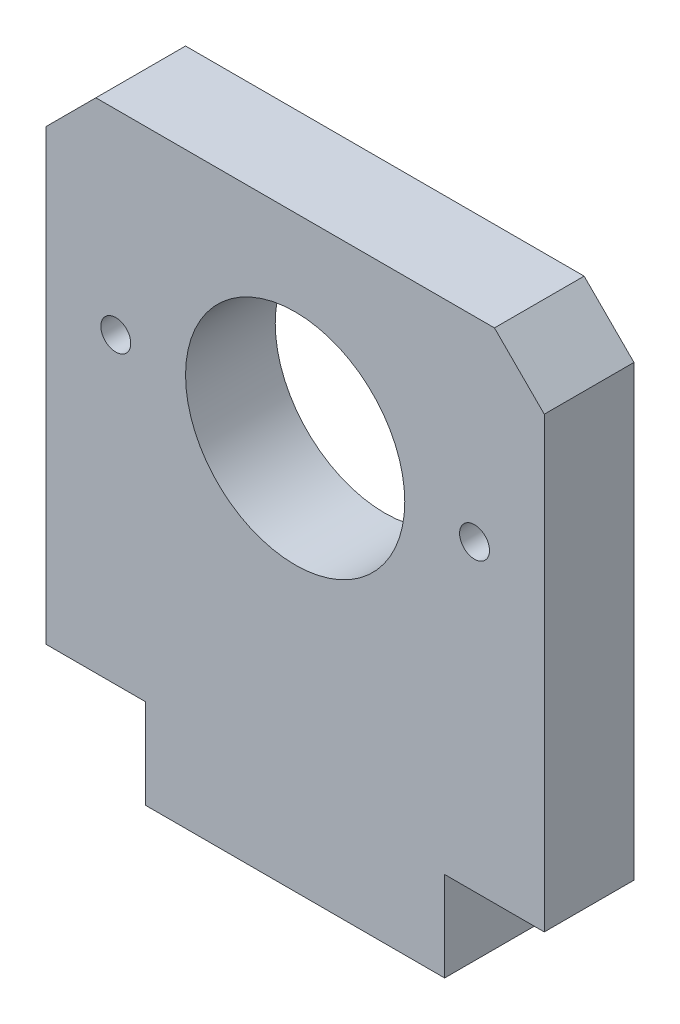
from build123d import *

# Parameters (mm, degrees)
SKETCH1_R           = 11
SKETCH1_R_2         = 1.5
BOSS_EXTRUDE1_DEPTH = 9


with BuildPart() as part:
    # Sketch1 → Boss-Extrude1 (new body)
    with BuildSketch(Plane.XY):
        Polygon((0, 0), (10, 0), (10, -9), (40, -9), (40, 0), (50, 0), (50, 45), (45, 50), (5, 50), (0, 45), align=None)
        with Locations((25, 30.4)):
            Circle(SKETCH1_R, mode=Mode.SUBTRACT)
        with Locations((7, 30.4)):
            Circle(SKETCH1_R_2, mode=Mode.SUBTRACT)
        with Locations(Location((43, 30.4, 0), (0, 0, 180))):
            Circle(SKETCH1_R_2, mode=Mode.SUBTRACT)
    extrude(amount=BOSS_EXTRUDE1_DEPTH)


solid = part.part
